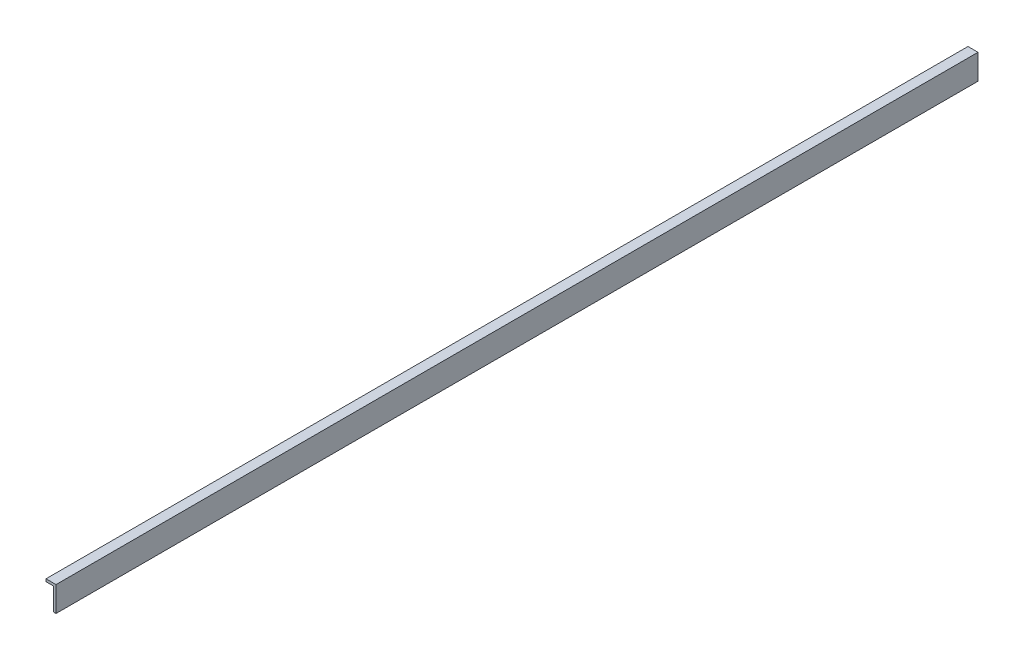
from build123d import *

# Parameters (mm, degrees)
STORE_KASET_L_RAF_4_SAG_1_START = -20
STORE_KASET_L_RAF_4_SAG_1_DEPTH = 735.5


with BuildPart() as part:
    # Sketch1 → STORE_kaset_L_raf_4_sag_1 (new body)
    with BuildSketch(Plane.XY.offset(STORE_KASET_L_RAF_4_SAG_1_START)):
        Polygon((649.5, 404.5), (651.5, 404.5), (651.5, 424.5), (643.5, 424.5), (643.5, 422.5), (649.5, 422.5), align=None)
    extrude(amount=-STORE_KASET_L_RAF_4_SAG_1_DEPTH)


solid = part.part
